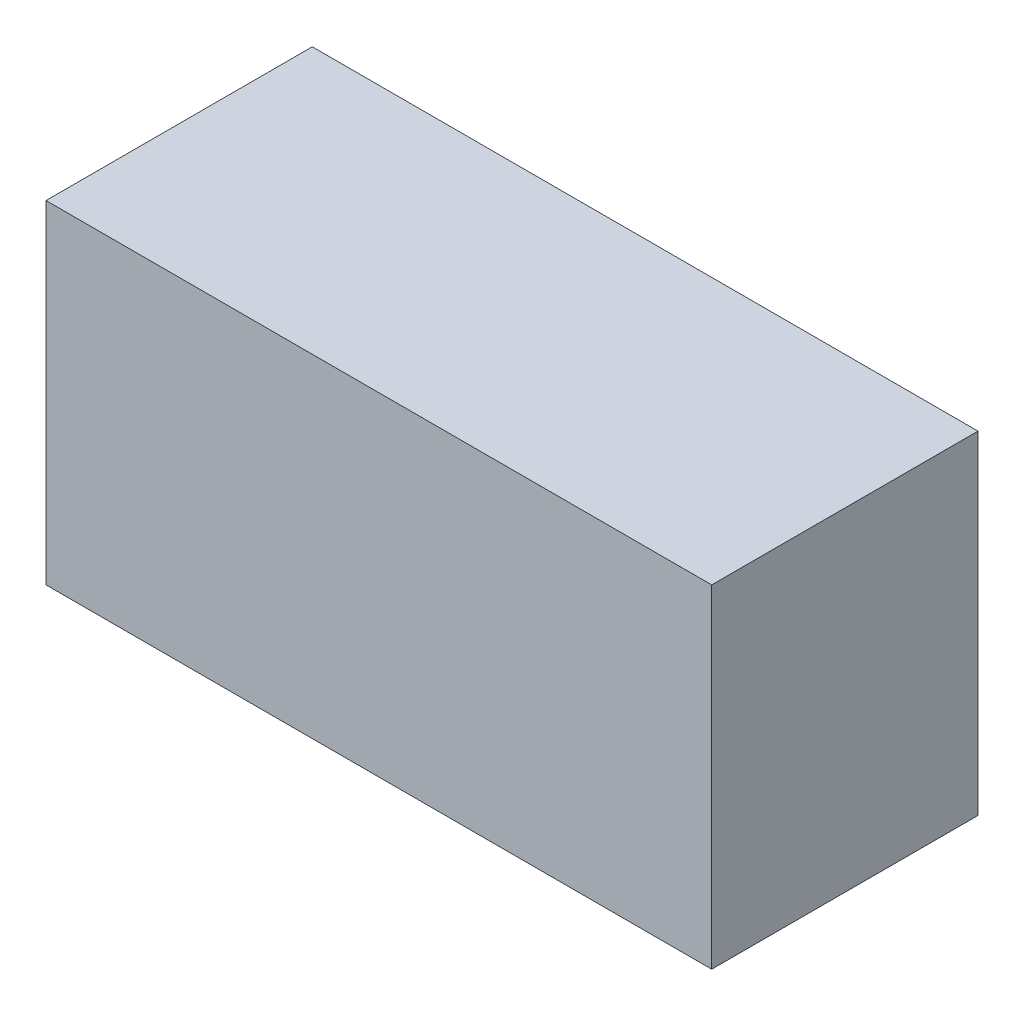
from build123d import *

# Parameters (mm, degrees)
ESBO_O1_W                = 200
ESBO_O1_H                = 100
RESSALTO_EXTRUS_O1_DEPTH = 80
ESBO_O2_W                = 190
ESBO_O2_H                = 90
CORTE_EXTRUS_O1_DEPTH    = 75


with BuildPart() as part:
    # Esboço1 → Ressalto-extrusão1 (new body)
    with BuildSketch(Plane.XY):
        Rectangle(ESBO_O1_W, ESBO_O1_H)
    extrude(amount=RESSALTO_EXTRUS_O1_DEPTH)

    # Esboço2 → Corte-extrusão1 (cut)
    with BuildSketch(Plane(origin=(0, 0, 0), x_dir=(-1, 0, 0), z_dir=(0, 0, -1))):
        Rectangle(ESBO_O2_W, ESBO_O2_H)
    extrude(amount=-CORTE_EXTRUS_O1_DEPTH, mode=Mode.SUBTRACT)


solid = part.part
